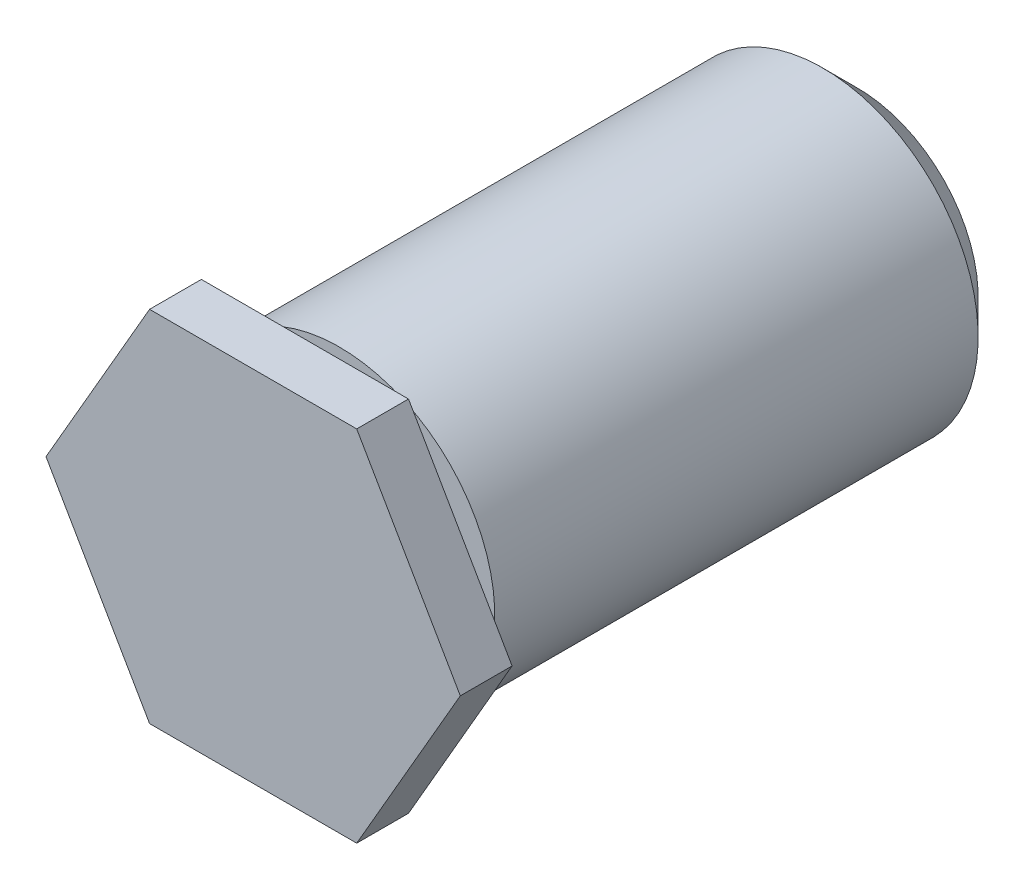
from build123d import *

# Parameters (mm, degrees)
EXTRUDE_1_DEPTH     = 3
CUT_EXTRUDE_1_DEPTH = 39.366652187


with BuildPart() as part:
    # 草图1 → 凸台-拉伸1 (new body)
    with BuildSketch(Plane.XY):
        Polygon((16, 0), (8, 13.856406461), (-8, 13.856406461), (-16, 0), (-8, -13.856406461), (8, -13.856406461), align=None)
    extrude(amount=EXTRUDE_1_DEPTH)

    # 草图2 → 旋转1 (revolve)
    with BuildSketch(Plane(origin=(0, 0, 0), x_dir=(0, 0, -1), z_dir=(1, 0, 0)), mode=Mode.PRIVATE) as revolve_1_sk:
        Polygon((0, 0), (0, 7), (2, 7), (2, 9), (30, 9), (32, 7), (32, 0), align=None)
    revolve(revolve_1_sk.sketch.rotate(Axis((0, 0, -32), (0, 0, 1)), 90), axis=Axis((0, 0, -32), (0, 0, 1)))

    # 草图4 → 切除-拉伸1 (cut, through all)
    with BuildSketch(Plane.XY):
        Polygon((16, 0), (8, 13.856406461), (-8, 13.856406461), (-16, 0), (-8, -13.856406461), (8, -13.856406461), align=None)
        Polygon((12, 0), (6, 10.392304845), (-6, 10.392304845), (-12, 0), (-6, -10.392304845), (6, -10.392304845), align=None, mode=Mode.SUBTRACT)
    extrude(amount=CUT_EXTRUDE_1_DEPTH, mode=Mode.SUBTRACT)


solid = part.part
